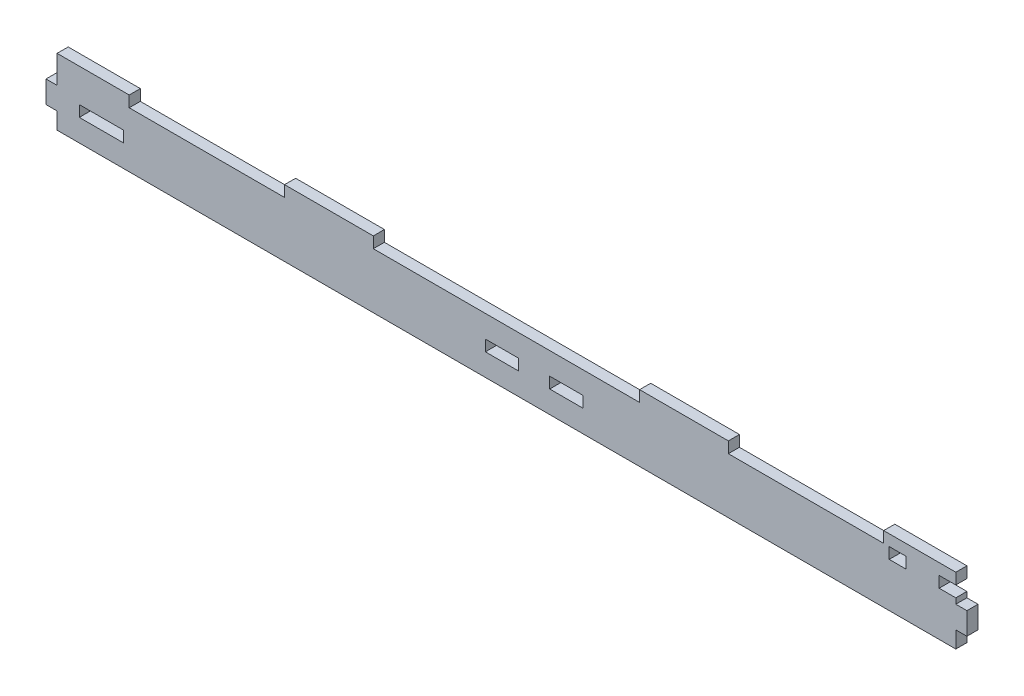
from build123d import *

# Parameters (mm, degrees)
SKETCH1_W           = 7.5
SKETCH1_H           = 5
SKETCH1_W_2         = 20
SKETCH1_W_3         = 15
BOSS_EXTRUDE1_DEPTH = 5


with BuildPart() as part:
    # Sketch1 → Boss-Extrude1 (new body)
    with BuildSketch(Plane.XY):
        Polygon((480, 177.5), (485, 177.5), (485, 187.5), (480, 187.5), (480, 190), (472.5, 190), (472.5, 195), (480, 195), (480, 200), (447.5, 200), (447.5, 195), (377.5, 195), (377.5, 200), (337.5, 200), (337.5, 195), (217.5, 195), (217.5, 200), (177.5, 200), (177.5, 195), (107.5, 195), (107.5, 200), (75, 200), (75, 195), (75, 187.5), (70, 187.5), (70, 177.5), (75, 177.5), (75, 170), (480, 170), align=None)
        with Locations((453.75, 192.5)):
            Rectangle(SKETCH1_W, SKETCH1_H, mode=Mode.SUBTRACT)
        with Locations((95, 182.5)):
            Rectangle(SKETCH1_W_2, SKETCH1_H, mode=Mode.SUBTRACT)
        with Locations((304.5, 182.5)):
            Rectangle(SKETCH1_W_3, SKETCH1_H, mode=Mode.SUBTRACT)
        with Locations((275.5, 182.5)):
            Rectangle(SKETCH1_W_3, SKETCH1_H, mode=Mode.SUBTRACT)
    extrude(amount=BOSS_EXTRUDE1_DEPTH)


solid = part.part
